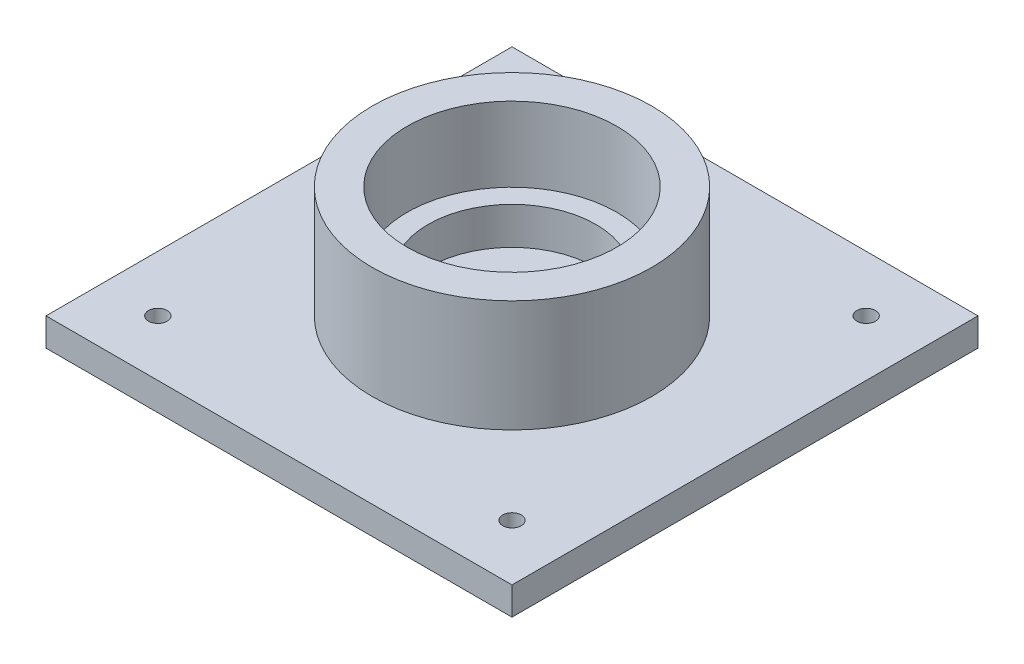
from build123d import *

# Parameters (mm, degrees)
SKETCH2_W               = 50
SKETCH2_H               = 50
BOSS_EXTRUDE1_DEPTH     = 15
SKETCH3_R               = 11.25
CUT_EXTRUDE1_DEPTH      = 8
SKETCH4_R               = 9
CUT_EXTRUDE2_DEPTH      = 4
SKETCH5_W               = 50
SKETCH5_H               = 50
SKETCH5_R               = 15
CUT_EXTRUDE3_DEPTH      = 12
CUT_EXTRUDE4_DEPTH      = 38.336309405
CUT_EXTRUDE4_DEPTH_BACK = 38.336309405
SKETCH6_R               = 1


with BuildPart() as part:
    # Sketch2 → Boss-Extrude1 (new body)
    with BuildSketch(Plane(origin=(0, 0, 0), x_dir=(1, 0, 0), z_dir=(0, 1, 0))):
        Rectangle(SKETCH2_W, SKETCH2_H)
    extrude(amount=BOSS_EXTRUDE1_DEPTH)

    # Sketch3 → Cut-Extrude1 (cut)
    with BuildSketch(Plane(origin=(0, 15, 0), x_dir=(1, 0, 0), z_dir=(0, 1, 0))):
        with Locations(Location((0, 0, 0), (0, 0, 270))):
            Circle(SKETCH3_R)
    extrude(amount=-CUT_EXTRUDE1_DEPTH, mode=Mode.SUBTRACT)

    # Sketch4 → Cut-Extrude2 (cut)
    with BuildSketch(Plane(origin=(0, 7, 0), x_dir=(1, 0, 0), z_dir=(0, 1, 0))):
        with Locations(Location((0, 0, 0), (0, 0, 270))):
            Circle(SKETCH4_R)
    extrude(amount=-CUT_EXTRUDE2_DEPTH, mode=Mode.SUBTRACT)

    # Sketch5 → Cut-Extrude3 (cut)
    with BuildSketch(Plane(origin=(0, 15, 0), x_dir=(1, 0, 0), z_dir=(0, 1, 0))):
        Rectangle(SKETCH5_W, SKETCH5_H)
        with Locations(Location((0, 0, 0), (0, 0, 270))):
            Circle(SKETCH5_R, mode=Mode.SUBTRACT)
    extrude(amount=-CUT_EXTRUDE3_DEPTH, mode=Mode.SUBTRACT)

    # Sketch6 → Cut-Extrude4 (cut, two sides: drawn at the far end of the back side and taken through both)
    with BuildSketch(Plane(origin=(0, 3, 0), x_dir=(1, 0, 0), z_dir=(0, 1, 0)).offset(-CUT_EXTRUDE4_DEPTH_BACK)):
        with Locations(Location((-19, 19, 0), (0, 0, 270))):
            Circle(SKETCH6_R)
        with Locations(Location((19, 19, 0), (0, 0, 270))):
            Circle(SKETCH6_R)
        with Locations(Location((19, -19, 0), (0, 0, 270))):
            Circle(SKETCH6_R)
        with Locations(Location((-19, -19, 0), (0, 0, 270))):
            Circle(SKETCH6_R)
    extrude(amount=CUT_EXTRUDE4_DEPTH + CUT_EXTRUDE4_DEPTH_BACK, mode=Mode.SUBTRACT)


solid = part.part
